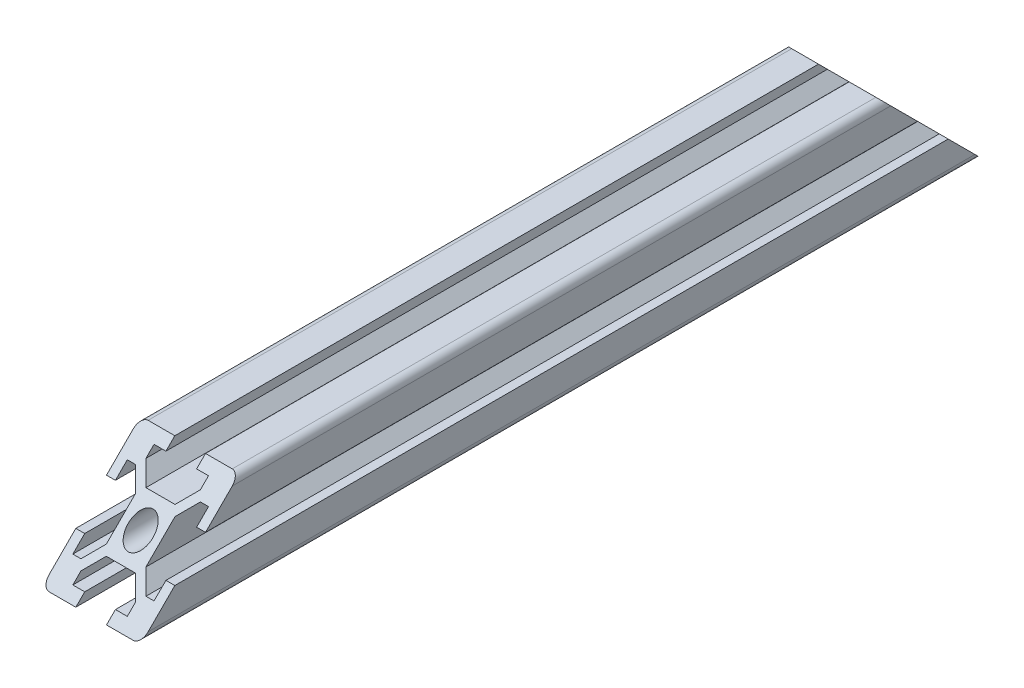
from build123d import *

# Parameters (mm, degrees)
SKETCH_1_R         = 2.5
EXTRUDE_2_DEPTH    = 170
SCALE1_SCALE       = 2.5
SKETCH1_W          = 66.249560654
SKETCH1_H          = 85.957176857
CUT_EXTRUDE1_DEPTH = 50


with BuildPart() as part:
    # 草图1 → 凸台-拉伸2 (new body)
    with BuildSketch(Plane.XY):
        with BuildLine():
            Line((5.5, -8.2), (5.5, -6.560660172))
            Line((5.5, -6.560660172), (2.939339828, -4))
            Line((2.939339828, -4), (-2.939339828, -4))
            Line((-2.939339828, -4), (-5.5, -6.560660172))
            Line((-5.5, -6.560660172), (-5.5, -8.2))
            Line((-5.5, -8.2), (-3.1, -8.2))
            Line((-3.1, -8.2), (-3.1, -10))
            Line((-3.1, -10), (-8.5, -10))
            ThreePointArc((-8.5, -10), (-9.560660172, -9.560660172), (-10, -8.5))
            Line((-10, -8.5), (-10, -3.1))
            Line((-10, -3.1), (-8.2, -3.1))
            Line((-8.2, -3.1), (-8.2, -5.5))
            Line((-8.2, -5.5), (-6.560660172, -5.5))
            Line((-6.560660172, -5.5), (-4, -2.939339828))
            Line((-4, -2.939339828), (-4, 2.939339828))
            Line((-4, 2.939339828), (-6.560660172, 5.5))
            Line((-6.560660172, 5.5), (-8.2, 5.5))
            Line((-8.2, 5.5), (-8.2, 3.1))
            Line((-8.2, 3.1), (-10, 3.1))
            Line((-10, 3.1), (-10, 8.5))
            ThreePointArc((-10, 8.5), (-9.560660172, 9.560660172), (-8.5, 10))
            Line((-8.5, 10), (-3.1, 10))
            Line((-3.1, 10), (-3.1, 8.2))
            Line((-3.1, 8.2), (-5.5, 8.2))
            Line((-5.5, 8.2), (-5.5, 6.560660172))
            Line((-5.5, 6.560660172), (-2.939339828, 4))
            Line((-2.939339828, 4), (2.939339828, 4))
            Line((2.939339828, 4), (5.5, 6.560660172))
            Line((5.5, 6.560660172), (5.5, 8.2))
            Line((5.5, 8.2), (3.1, 8.2))
            Line((3.1, 8.2), (3.1, 10))
            Line((3.1, 10), (8.5, 10))
            ThreePointArc((8.5, 10), (9.560660172, 9.560660172), (10, 8.5))
            Line((10, 8.5), (10, 3.1))
            Line((10, 3.1), (8.2, 3.1))
            Line((8.2, 3.1), (8.2, 5.5))
            Line((8.2, 5.5), (6.560660172, 5.5))
            Line((6.560660172, 5.5), (4, 2.939339828))
            Line((4, 2.939339828), (4, -2.939339828))
            Line((4, -2.939339828), (6.560660172, -5.5))
            Line((6.560660172, -5.5), (8.2, -5.5))
            Line((8.2, -5.5), (8.2, -3.1))
            Line((8.2, -3.1), (10, -3.1))
            Line((10, -3.1), (10, -8.5))
            ThreePointArc((10, -8.5), (9.560660172, -9.560660172), (8.5, -10))
            Line((8.5, -10), (3.1, -10))
            Line((3.1, -10), (3.1, -8.2))
            Line((3.1, -8.2), (5.5, -8.2))
        make_face()
        Circle(SKETCH_1_R, mode=Mode.SUBTRACT)
    extrude(amount=-EXTRUDE_2_DEPTH)


with BuildPart() as part_1:
    # Scale1: scaled about (0, 0, 0)
    add(part.part.scale(SCALE1_SCALE))

    # Sketch1 → Cut-Extrude1 (cut)
    with BuildSketch(Plane(origin=(0, 200, -200), x_dir=(1, 0, 0), z_dir=(1.0176525195173148e-14, 0.7071067811865488, -0.7071067811865464))):
        with Locations((1.305108883, 276.28516192)):
            Rectangle(SKETCH1_W, SKETCH1_H)
    cut_extrude1 = extrude(amount=CUT_EXTRUDE1_DEPTH, mode=Mode.SUBTRACT)

    # Mirror1: Cut-Extrude1 across plane
    add(cut_extrude1.mirror(Plane.XY.offset(-212.5)), mode=Mode.SUBTRACT)


solid = part_1.part
